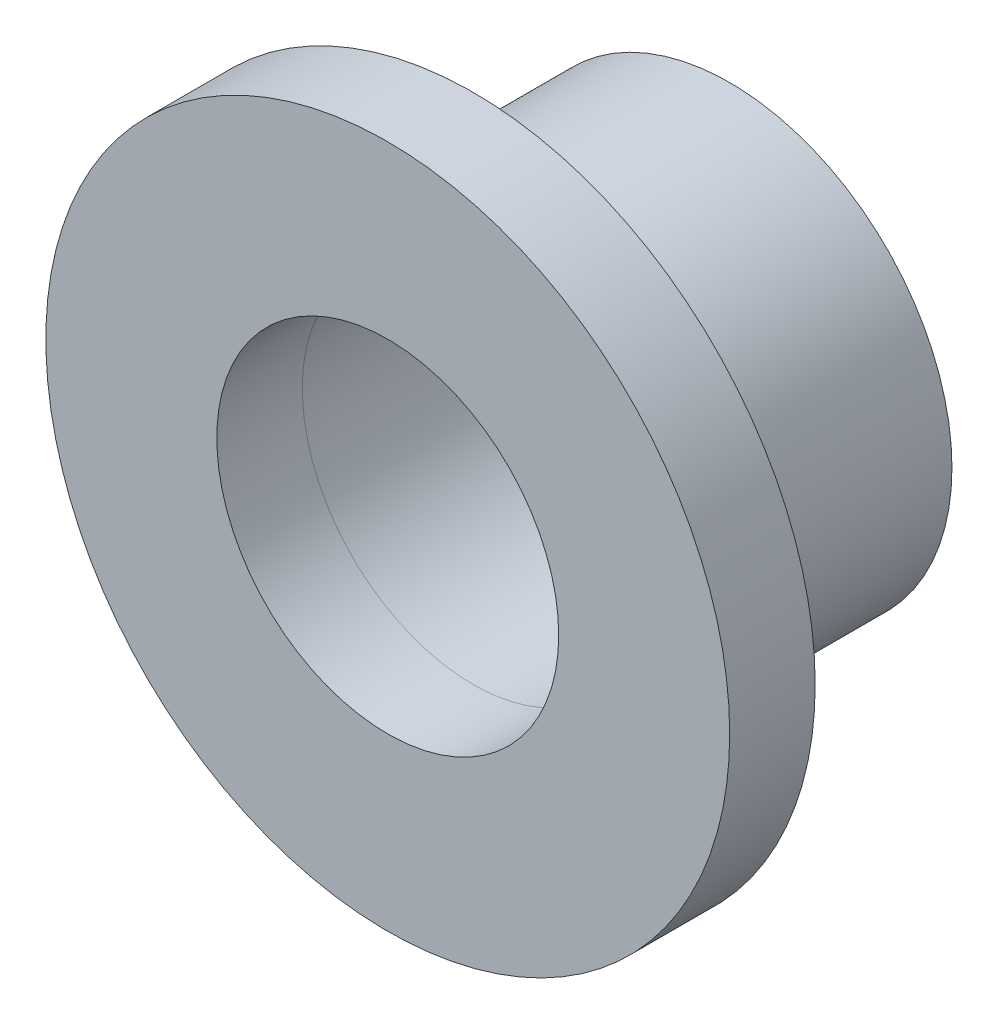
from build123d import *

# Parameters (mm, degrees)
SKETCH1_R           = 13
SKETCH1_R_2         = 10
BOSS_EXTRUDE1_DEPTH = 15
SKETCH2_R           = 20
SKETCH2_R_2         = 10
BOSS_EXTRUDE2_DEPTH = 5


with BuildPart() as part:
    # Sketch1 → Boss-Extrude1 (new body)
    with BuildSketch(Plane.XY):
        Circle(SKETCH1_R)
        Circle(SKETCH1_R_2, mode=Mode.SUBTRACT)
    extrude(amount=BOSS_EXTRUDE1_DEPTH)


with BuildPart() as body_2:
    # Sketch2 → Boss-Extrude2 (new body)
    with BuildSketch(Plane.XY.offset(15)):
        Circle(SKETCH2_R)
        Circle(SKETCH2_R_2, mode=Mode.SUBTRACT)
    extrude(amount=BOSS_EXTRUDE2_DEPTH)


solid = Compound([part.part, body_2.part])
